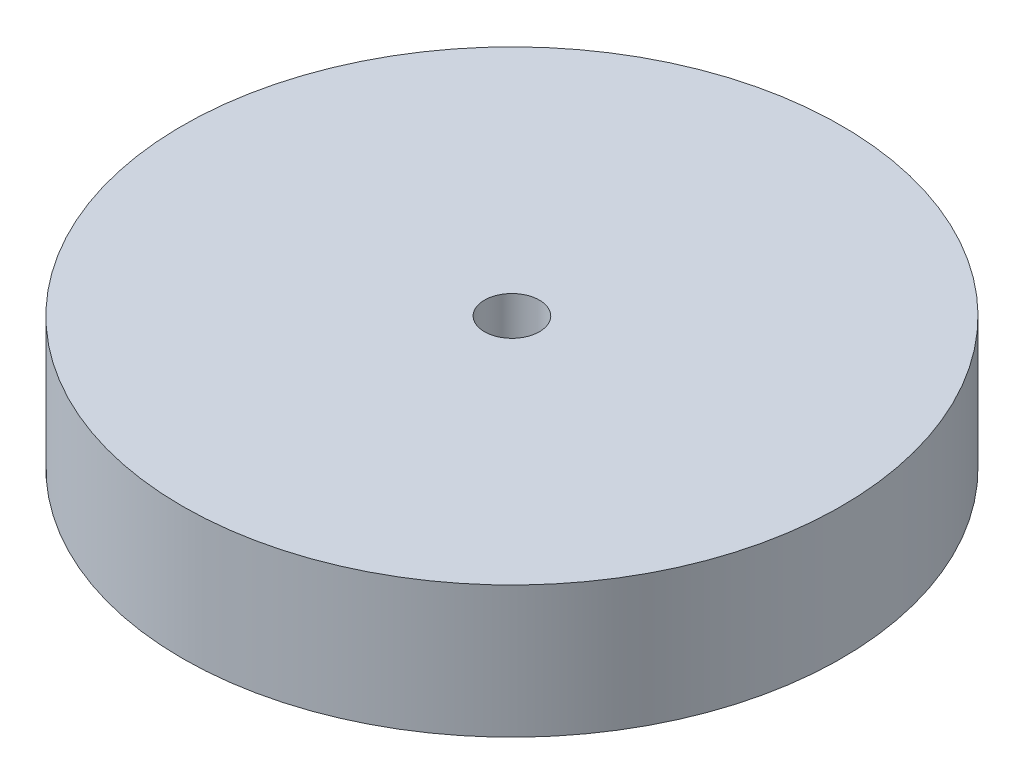
from build123d import *

# Parameters (mm, degrees)
SKETCH1_R           = 30
BOSS_EXTRUDE1_DEPTH = 12
SKETCH3_R           = 2.5
CUT_EXTRUDE3_DEPTH  = 6
SKETCH4_R           = 5
CUT_EXTRUDE4_DEPTH  = 6


with BuildPart() as part:
    # Sketch1 → Boss-Extrude1 (new body)
    with BuildSketch(Plane(origin=(0, 0, 0), x_dir=(1, 0, 0), z_dir=(0, 1, 0))):
        with Locations(Location((0, 0, 0), (0, 0, 270))):
            Circle(SKETCH1_R)
    extrude(amount=BOSS_EXTRUDE1_DEPTH)

    # Sketch3 → Cut-Extrude3 (cut)
    with BuildSketch(Plane(origin=(0, 12, 0), x_dir=(1, 0, 0), z_dir=(0, 1, 0))):
        with Locations(Location((0, 0, 0), (0, 0, 270))):
            Circle(SKETCH3_R)
    extrude(amount=-CUT_EXTRUDE3_DEPTH, mode=Mode.SUBTRACT)

    # Sketch4 → Cut-Extrude4 (cut)
    with BuildSketch(Plane.XZ):
        with Locations(Location((0, 0, 0), (0, 0, 270))):
            Circle(SKETCH4_R)
    extrude(amount=-CUT_EXTRUDE4_DEPTH, mode=Mode.SUBTRACT)


solid = part.part
